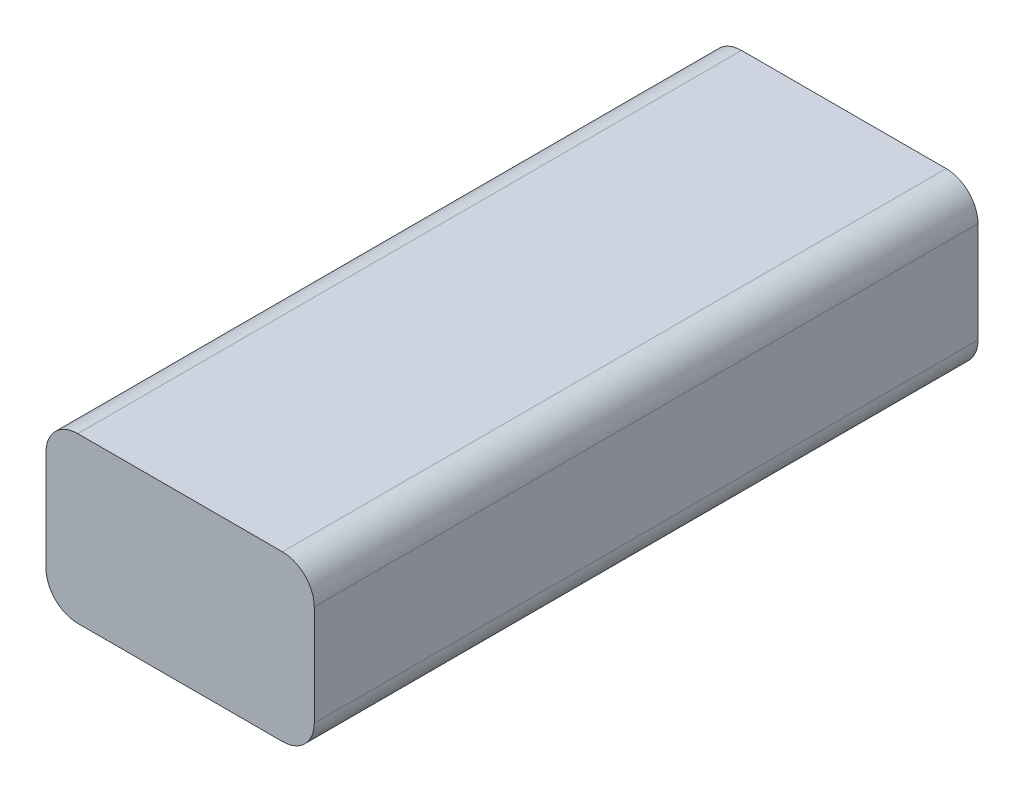
from build123d import *

# Parameters (mm, degrees)
HOLDER_OUTLINE_W                    = 25.3
HOLDER_OUTLINE_H                    = 62.6
F_2XAAA_HOLDER_25_3X62_6X15_5_DEPTH = 15.5
LONG_EDGE_FILLETS_R3_R              = 3
SLIDE_SWITCH_LEVER_SKETCH_W         = 3
SLIDE_SWITCH_LEVER_SKETCH_H         = 3
SLIDE_SWITCH_LEVER_3X3X1_3_DEPTH    = 1.3


with BuildPart() as part:
    # Holder Outline → 2xAAA Holder 25.3x62.6x15.5 (new body)
    with BuildSketch(Plane(origin=(0, 0, 0), x_dir=(1, 0, 0), z_dir=(0, 1, 0))):
        Rectangle(HOLDER_OUTLINE_W, HOLDER_OUTLINE_H)
    extrude(amount=F_2XAAA_HOLDER_25_3X62_6X15_5_DEPTH)

    # Long Edge Fillets R3
    long_edge_fillets_r3_edges = [part.edges().sort_by_distance(p)[0] for p in [
        (12.65, 15.5, 0),
        (-12.65, 15.5, 0),
        (12.65, 0, 0),
        (-12.65, 0, 0),
    ]]
    fillet(long_edge_fillets_r3_edges, radius=LONG_EDGE_FILLETS_R3_R)

    # Slide Switch Lever Sketch → Slide Switch Lever 3x3x1.3 (add)
    with BuildSketch(Plane(origin=(0, 0, 0), x_dir=(1, 0, 0), z_dir=(0, 1, 0))):
        with Locations((0, 25.3)):
            Rectangle(SLIDE_SWITCH_LEVER_SKETCH_W, SLIDE_SWITCH_LEVER_SKETCH_H)
    extrude(amount=-SLIDE_SWITCH_LEVER_3X3X1_3_DEPTH)


solid = part.part
